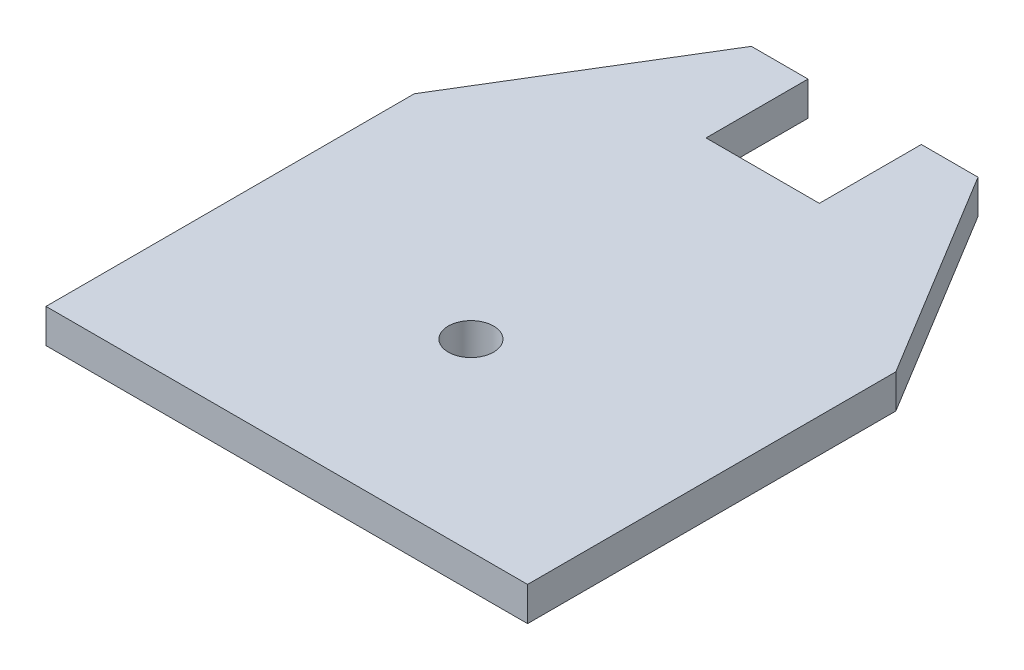
from build123d import *

# Parameters (mm, degrees)
SKETCH_1_W          = 85
SKETCH_1_H          = 102
EXTRUDE_1_DEPTH     = 6
CUT_EXTRUDE_1_DEPTH = 75.861411438
SKETCH_3_R          = 4
CUT_EXTRUDE_2_DEPTH = 75.861411438
SKETCH_4_W          = 20
SKETCH_4_H          = 18
CUT_EXTRUDE_3_DEPTH = 75.861411438


with BuildPart() as part:
    # Эскиз1 → Вытянуть1 (new body)
    with BuildSketch(Plane(origin=(0, 0, 0), x_dir=(1, 0, 0), z_dir=(0, 1, 0))):
        with Locations((0, -10.334989382)):
            Rectangle(SKETCH_1_W, SKETCH_1_H)
    extrude(amount=EXTRUDE_1_DEPTH)

    # Эскиз2 → Вырез-Вытянуть1 (cut, through all)
    with BuildSketch(Plane(origin=(0, 6, 0), x_dir=(1, 0, 0), z_dir=(0, 1, 0))):
        Polygon((42.5, 3.665010618), (20, 40.665010618), (42.5, 40.665010618), align=None)
        Polygon((-42.5, 40.665010618), (-42.5, 3.665010618), (-20, 40.665010618), align=None)
    extrude(amount=-CUT_EXTRUDE_1_DEPTH, mode=Mode.SUBTRACT)

    # Эскиз3 → Вырез-Вытянуть2 (cut, through all)
    with BuildSketch(Plane(origin=(0, 6, 0), x_dir=(1, 0, 0), z_dir=(0, 1, 0))):
        with Locations(Location((0, -28.834989382, 0), (0, 0, 270))):
            Circle(SKETCH_3_R)
    extrude(amount=-CUT_EXTRUDE_2_DEPTH, mode=Mode.SUBTRACT)

    # Эскиз4 → Вырез-Вытянуть3 (cut, through all)
    with BuildSketch(Plane(origin=(0, 6, 0), x_dir=(1, 0, 0), z_dir=(0, 1, 0))):
        with Locations((3.2e-08, 31.665010618)):
            Rectangle(SKETCH_4_W, SKETCH_4_H)
    extrude(amount=-CUT_EXTRUDE_3_DEPTH, mode=Mode.SUBTRACT)


solid = part.part
